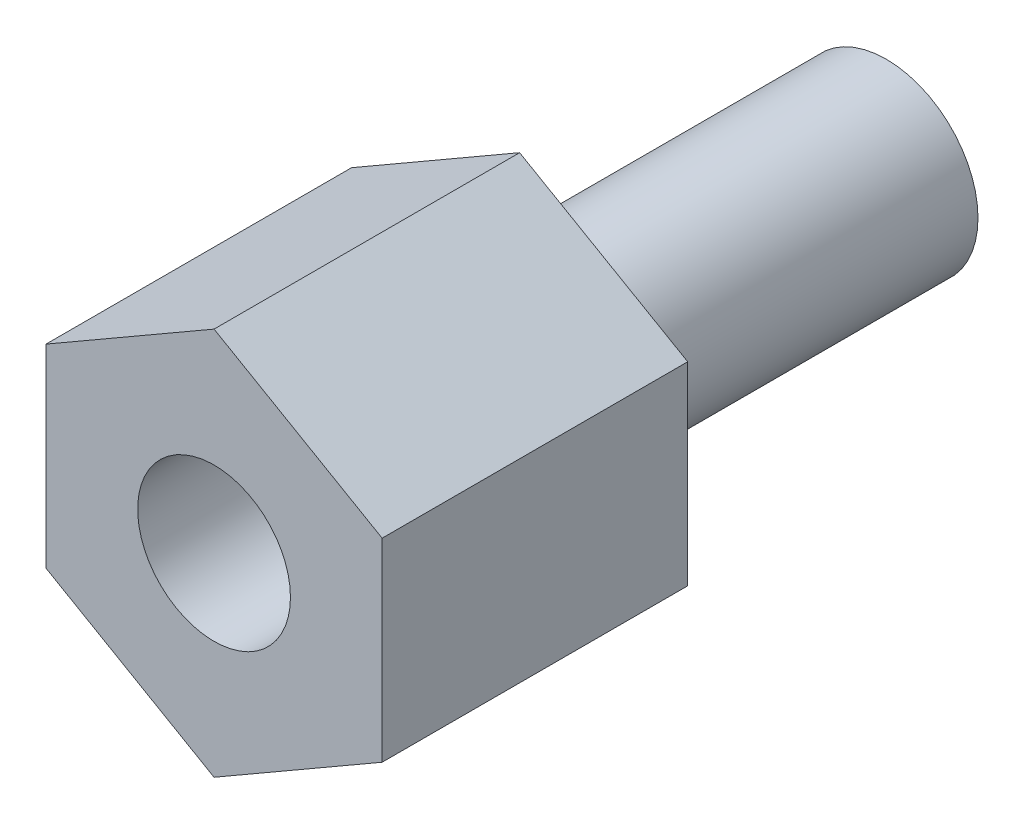
from build123d import *

# Parameters (mm, degrees)
HEX_2_DEPTH  = 5
SK_MALE_R    = 1.5
MALE_DEPTH   = 6
SK_FEMALE_R  = 1.25
FEMALE_DEPTH = 8.324331596


with BuildPart() as part:
    # SK_hex → Hex 2 (new body)
    with BuildSketch(Plane.XY):
        Polygon((2.75, 1.58771324), (2.75, -1.58771324), (0, -3.175426481), (-2.75, -1.58771324), (-2.75, 1.58771324), (0, 3.175426481), align=None)
    extrude(amount=HEX_2_DEPTH)

    # SK_male → Male (add)
    with BuildSketch(Plane.XY):
        Circle(SK_MALE_R)
    extrude(amount=-MALE_DEPTH)

    # SK_female → Female (cut, through all)
    with BuildSketch(Plane.XY):
        Circle(SK_FEMALE_R)
    extrude(amount=FEMALE_DEPTH, mode=Mode.SUBTRACT)


solid = part.part
